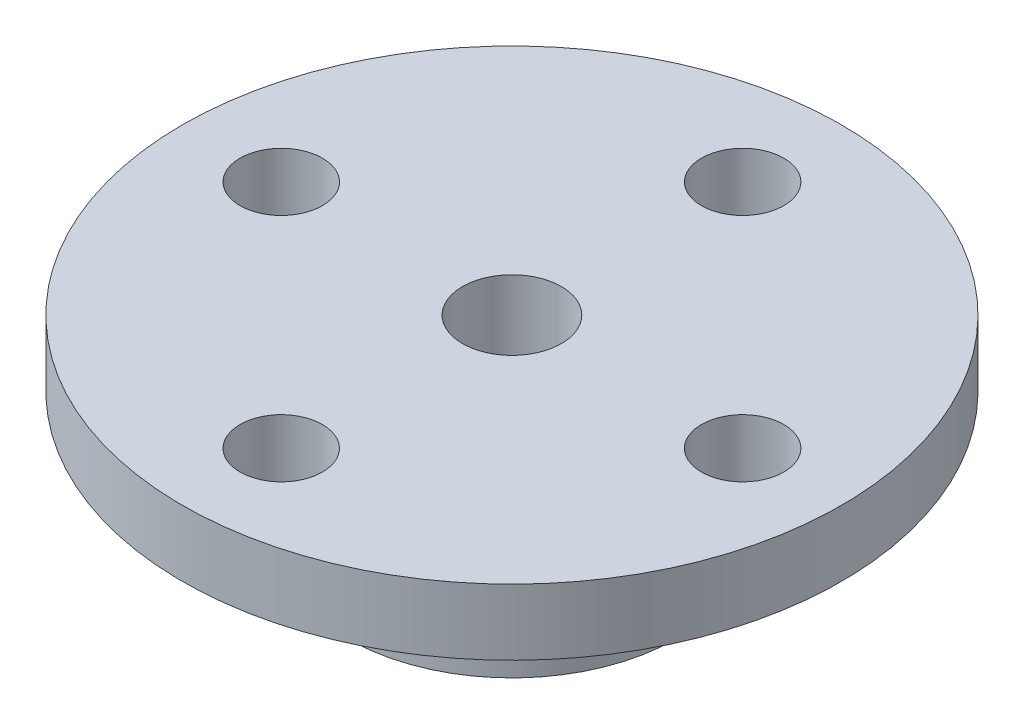
from build123d import *

# Parameters (mm, degrees)
HOLE_WIZARD_M3_1_D = 2.5


with BuildPart() as part:
    # 草图1 → 旋转1 (revolve)
    with BuildSketch(Plane.XY, mode=Mode.PRIVATE) as revolve_1_sk:
        Polygon((10, 0), (1.5, 0), (1.5, -3), (3, -3), (3, -6), (5, -6), (5, -2), (10, -2), align=None)
    revolve(revolve_1_sk.sketch.rotate(Axis((0, 0, 0), (0, -1, 0)), 180), axis=Axis((0, 0, 0), (0, -1, 0)))

    # M3 螺纹孔1 (through all)
    with Locations(Plane(origin=(0, -2, 0), x_dir=(-1, 0, 0), z_dir=(0, -1, 0))):
        with Locations((7, 0), (0, -7), (-7, 0), (0, 7)):
            Hole(HOLE_WIZARD_M3_1_D / 2)


solid = part.part
